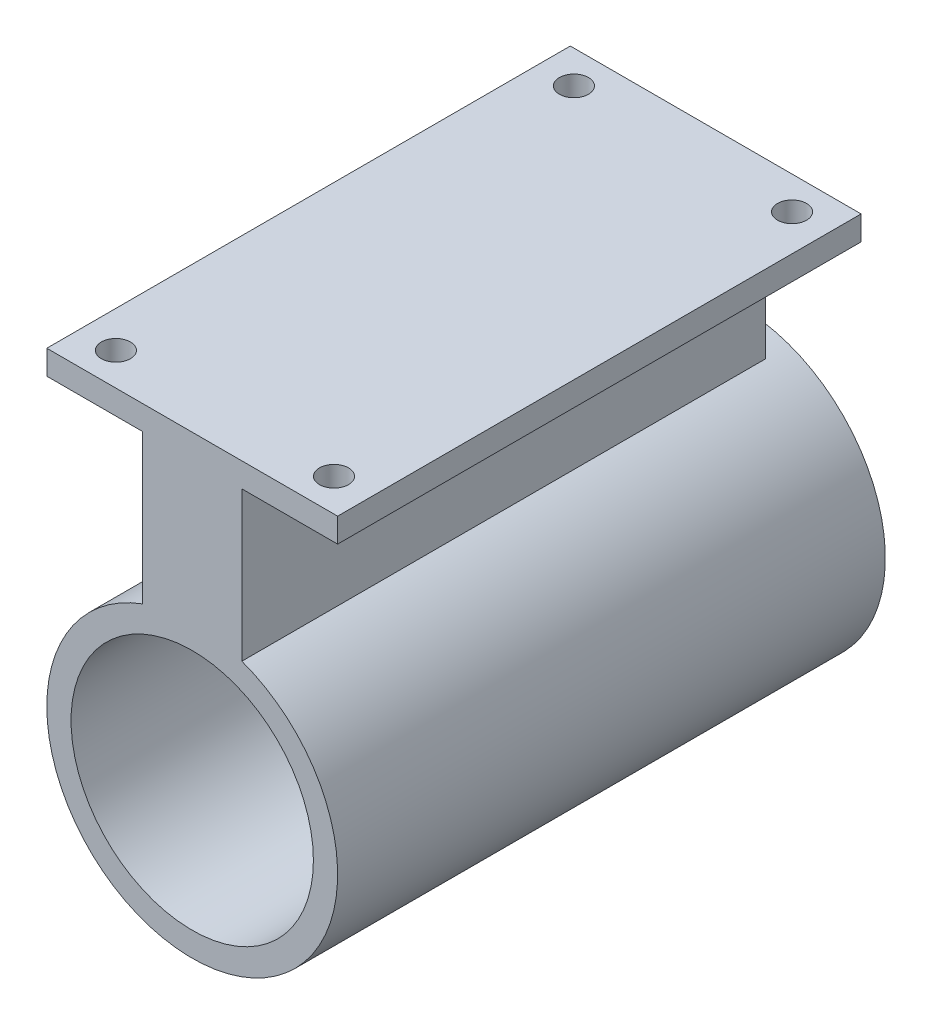
from build123d import *

# Parameters (mm, degrees)
CROQUIS1_R              = 12.5
SALIENTE_EXTRUIR1_DEPTH = 54
SALIENTE_EXTRUIR2_START = 2.5
CROQUIS2_R              = 15
SALIENTE_EXTRUIR2_DEPTH = 2.5
CROQUIS3_R              = 3.75
CORTAR_EXTRUIR2_DEPTH   = 2.5
CROQUIS5_R              = 1.5
CORTAR_EXTRUIR3_DEPTH   = 2.5
CROQUIS9_R              = 1.5
CORTAR_EXTRUIR5_DEPTH   = 2.5


with BuildPart() as part:
    # Croquis1 → Saliente-Extruir1 (new body)
    with BuildSketch(Plane.XY):
        with BuildLine():
            Line((-5.119897429, -1.25), (-15, -1.25))
            Line((-15, -1.25), (-15, 1.25))
            Line((-15, 1.25), (15, 1.25))
            Line((15, 1.25), (15, -1.25))
            Line((15, -1.25), (5.119897429, -1.25))
            Line((5.119897429, -1.25), (5.119897429, -13.25))
            Line((5.119897429, -13.25), (5.119897429, -16.650828027))
            ThreePointArc((5.119897429, -16.650828027), (0, -45.75), (-5.119897429, -16.650828027))
            Line((-5.119897429, -16.650828027), (-5.119897429, -13.25))
            Line((-5.119897429, -13.25), (-5.119897429, -1.25))
        make_face()
        with Locations((0, -30.75)):
            Circle(CROQUIS1_R, mode=Mode.SUBTRACT)
    extrude(amount=SALIENTE_EXTRUIR1_DEPTH)

    # Croquis2 → Saliente-Extruir2 (add)
    with BuildSketch(Plane(origin=(0, 0, 0), x_dir=(-1, 0, 0), z_dir=(0, 0, -1)).offset(SALIENTE_EXTRUIR2_START)):
        with Locations((0, -30.75)):
            Circle(CROQUIS2_R)
    extrude(amount=-SALIENTE_EXTRUIR2_DEPTH)

    # Croquis3 → Cortar-Extruir2 (cut)
    with BuildSketch(Plane(origin=(0, 0, -2.5), x_dir=(-1, 0, 0), z_dir=(0, 0, -1))):
        with Locations((0, -30.75)):
            Circle(CROQUIS3_R)
    extrude(amount=-CORTAR_EXTRUIR2_DEPTH, mode=Mode.SUBTRACT)

    # Croquis5 → Cortar-Extruir3 (cut)
    with BuildSketch(Plane(origin=(0, 0, -2.5), x_dir=(-1, 0, 0), z_dir=(0, 0, -1))):
        with Locations((0, -22.25)):
            Circle(CROQUIS5_R)
        with Locations((0, -39.25)):
            Circle(CROQUIS5_R)
    extrude(amount=-CORTAR_EXTRUIR3_DEPTH, mode=Mode.SUBTRACT)

    # Croquis9 → Cortar-Extruir5 (cut)
    with BuildSketch(Plane(origin=(0, 1.25, 0), x_dir=(1, 0, 0), z_dir=(0, 1, 0))):
        with Locations((-11.25, -50.625)):
            Circle(CROQUIS9_R)
        with Locations((-11.25, -3.375)):
            Circle(CROQUIS9_R)
        with Locations((11.25, -50.625)):
            Circle(CROQUIS9_R)
        with Locations((11.25, -3.375)):
            Circle(CROQUIS9_R)
    extrude(amount=-CORTAR_EXTRUIR5_DEPTH, mode=Mode.SUBTRACT)


solid = part.part
